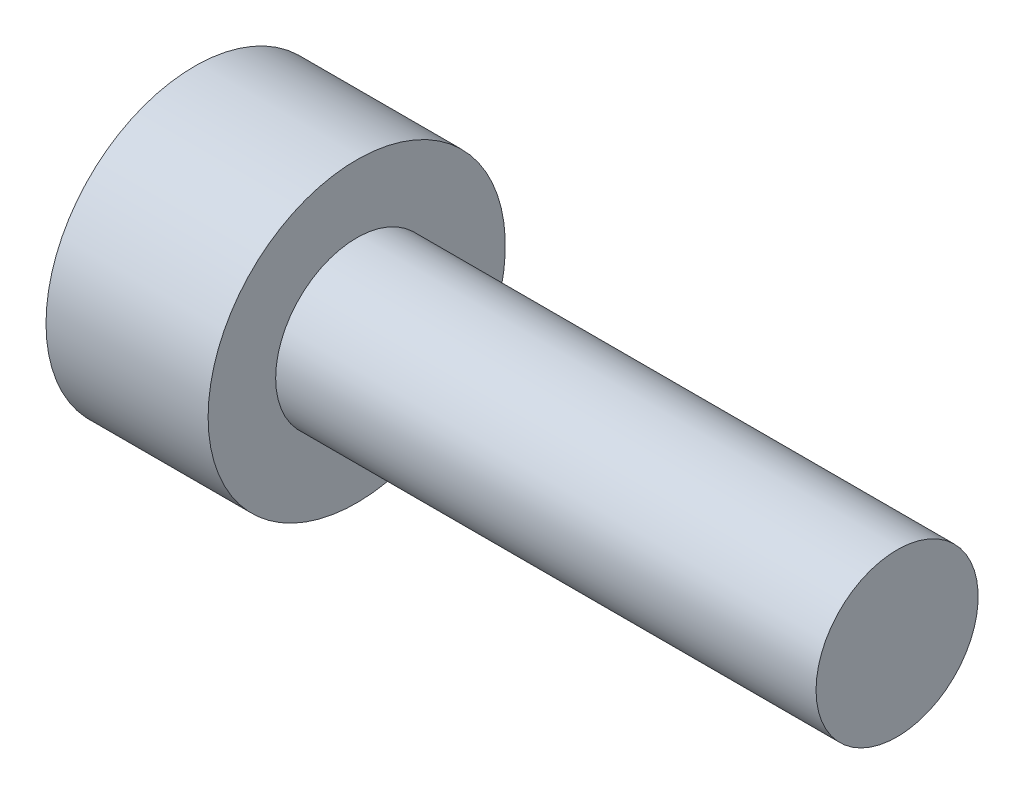
from build123d import *


with BuildPart() as part:
    # Axial profile (mm) → Full revolution (revolve)
    with BuildSketch(Plane.XY, mode=Mode.PRIVATE) as full_revolution_sk:
        Polygon((128.7, 0), (141.7, 0), (141.7, 1.5), (131.7, 1.5), (131.7, 2.75), (128.7, 2.75), align=None)
    revolve(full_revolution_sk.sketch.rotate(Axis((-110, 0, 0), (1, 0, 0)), 90), axis=Axis((-110, 0, 0), (1, 0, 0)))


solid = part.part
